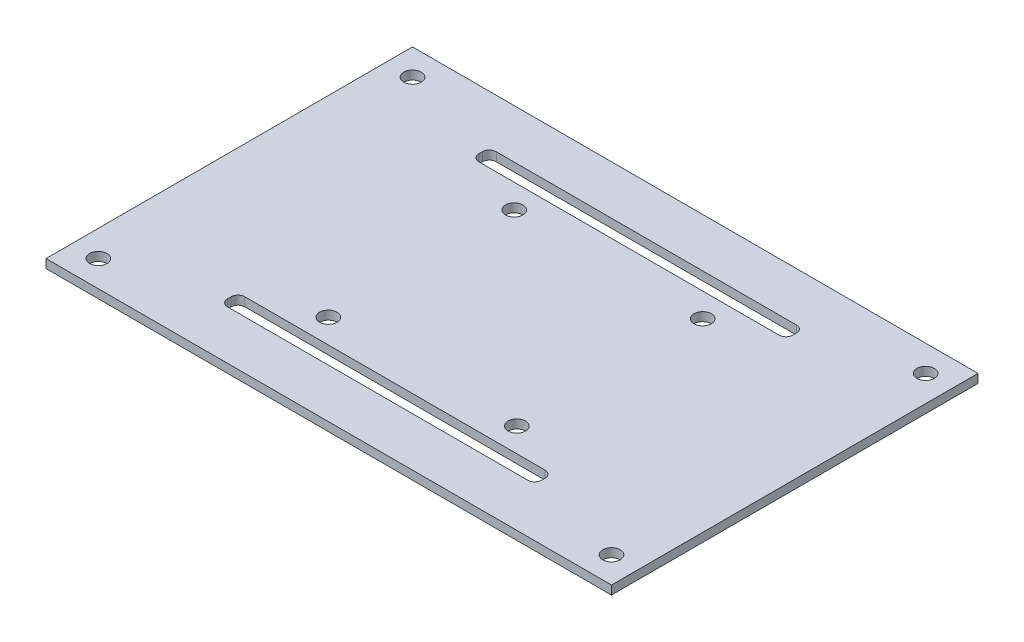
from build123d import *

# Parameters (mm, degrees)
SKETCH1_W           = 205.74
SKETCH1_H           = 133.35
BOSS_EXTRUDE1_DEPTH = 3.175
SKETCH3_R           = 3.175
CUT_EXTRUDE3_DEPTH  = 123.629006153
SKETCH4_R           = 3.175
CUT_EXTRUDE4_DEPTH  = 123.629006153
CUT_EXTRUDE5_DEPTH  = 123.629006153


with BuildPart() as part:
    # Sketch1 → Boss-Extrude1 (new body)
    with BuildSketch(Plane(origin=(0, 0, 0), x_dir=(1, 0, 0), z_dir=(0, 1, 0))):
        Rectangle(SKETCH1_W, SKETCH1_H)
    extrude(amount=BOSS_EXTRUDE1_DEPTH)

    # Sketch3 → Cut-Extrude3 (cut, through all)
    with BuildSketch(Plane(origin=(0, 3.175, 0), x_dir=(1, 0, 0), z_dir=(0, 1, 0))):
        with Locations(Location((35.56, 33.812500066, 0), (0, 0, 270))):
            Circle(SKETCH3_R)
        with Locations(Location((35.56, -33.812500066, 0), (0, 0, 270))):
            Circle(SKETCH3_R)
        with Locations(Location((-33.02, -33.812500066, 0), (0, 0, 270))):
            Circle(SKETCH3_R)
        with Locations(Location((-33.02, 33.812500066, 0), (0, 0, 270))):
            Circle(SKETCH3_R)
    extrude(amount=-CUT_EXTRUDE3_DEPTH, mode=Mode.SUBTRACT)

    # Sketch4 → Cut-Extrude4 (cut, through all)
    with BuildSketch(Plane(origin=(0, 3.175, 0), x_dir=(1, 0, 0), z_dir=(0, 1, 0))):
        with Locations(Location((-93.345, 57.15, 0), (0, 0, 270))):
            Circle(SKETCH4_R)
        with Locations(Location((93.345, 57.15, 0), (0, 0, 270))):
            Circle(SKETCH4_R)
        with Locations(Location((93.345, -57.15, 0), (0, 0, 90))):
            Circle(SKETCH4_R)
        with Locations(Location((-93.345, -57.15, 0), (0, 0, 90))):
            Circle(SKETCH4_R)
    extrude(amount=-CUT_EXTRUDE4_DEPTH, mode=Mode.SUBTRACT)

    # Sketch5 → Cut-Extrude5 (cut, through all)
    with BuildSketch(Plane(origin=(0, 3.175, 0), x_dir=(1, 0, 0), z_dir=(0, 1, 0))):
        with BuildLine():
            Line((-54.61, -42.545), (54.61, -42.545))
            ThreePointArc((54.61, -42.545), (56.406051224, -43.288948776), (57.15, -45.085))
            Line((57.15, -45.085), (57.15, -46.355))
            ThreePointArc((57.15, -46.355), (56.406051224, -48.151051224), (54.61, -48.895))
            Line((54.61, -48.895), (-54.61, -48.895))
            ThreePointArc((-54.61, -48.895), (-56.406051224, -48.151051224), (-57.15, -46.355))
            Line((-57.15, -46.355), (-57.15, -45.085))
            ThreePointArc((-57.15, -45.085), (-56.406051224, -43.288948776), (-54.61, -42.545))
        make_face()
        with BuildLine():
            Line((57.15, 45.085), (57.15, 46.355))
            ThreePointArc((57.15, 46.355), (56.406051224, 48.151051224), (54.61, 48.895))
            Line((54.61, 48.895), (-54.61, 48.895))
            ThreePointArc((-54.61, 48.895), (-56.406051224, 48.151051224), (-57.15, 46.355))
            Line((-57.15, 46.355), (-57.15, 45.085))
            ThreePointArc((-57.15, 45.085), (-56.406051224, 43.288948776), (-54.61, 42.545))
            Line((-54.61, 42.545), (54.61, 42.545))
            ThreePointArc((54.61, 42.545), (56.406051224, 43.288948776), (57.15, 45.085))
        make_face()
    extrude(amount=-CUT_EXTRUDE5_DEPTH, mode=Mode.SUBTRACT)


solid = part.part
